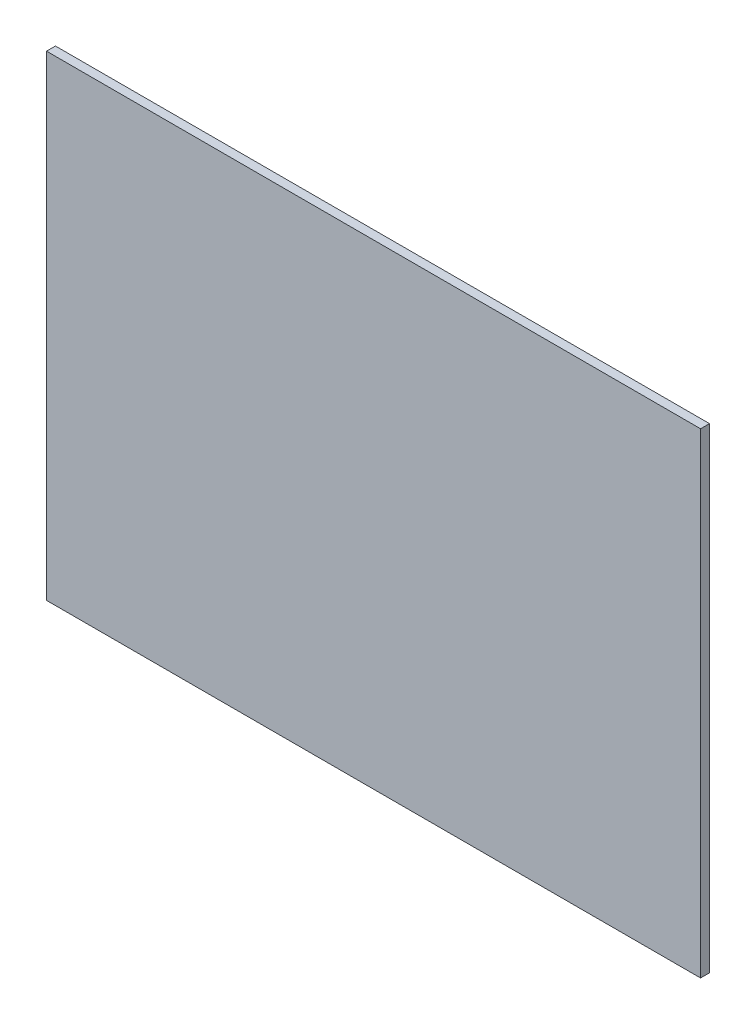
from build123d import *

# Parameters (mm, degrees)
SCHIZZO1_W                   = 110
SCHIZZO1_H                   = 80
ESTRUSIONE_ESTRUSIONE1_DEPTH = 1.5


with BuildPart() as part:
    # Schizzo1 → Estrusione-Estrusione1 (new body)
    with BuildSketch(Plane.XY):
        with Locations((-55, 40)):
            Rectangle(SCHIZZO1_W, SCHIZZO1_H)
    extrude(amount=ESTRUSIONE_ESTRUSIONE1_DEPTH)


solid = part.part
